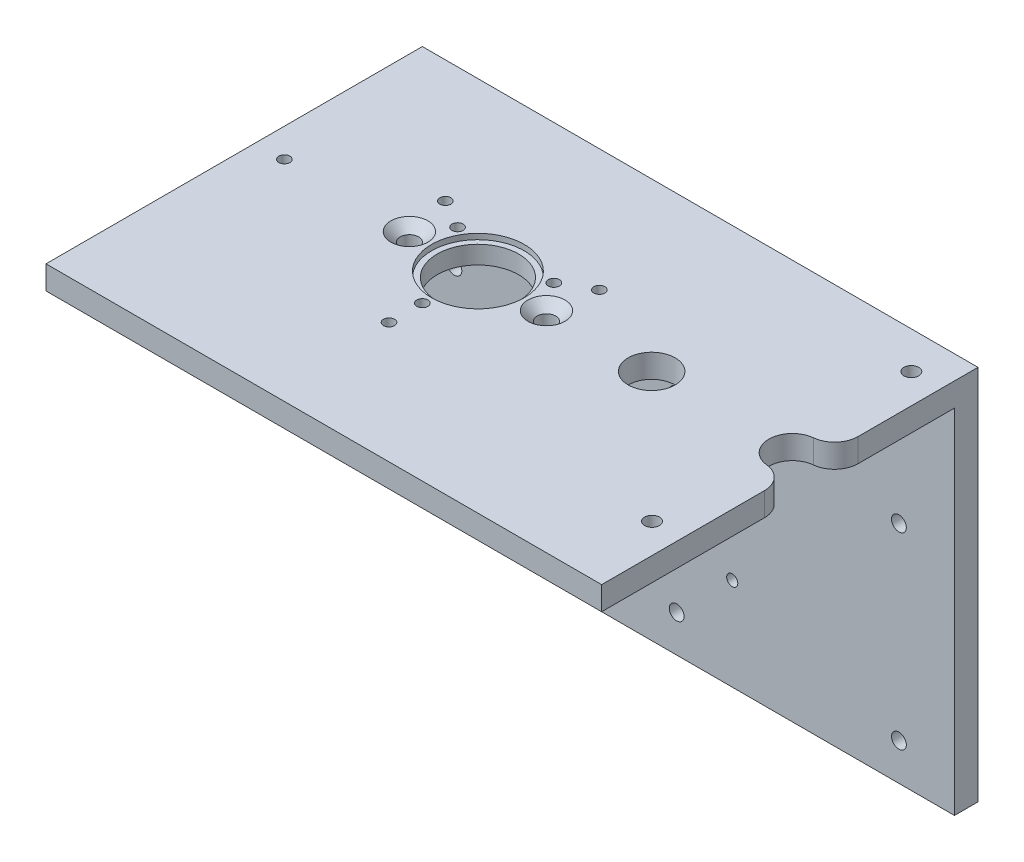
from build123d import *

# Parameters (mm, degrees)
CROQUIS1_W              = 150
CROQUIS1_H              = 101.6
SALIENTE_EXTRUIR1_DEPTH = 3.175
CROQUIS2_R              = 2
CROQUIS2_R_2            = 11
CROQUIS2_R_3            = 1.5
CROQUIS2_R_4            = 6.35
CORTAR_EXTRUIR1_DEPTH   = 91.807282197
REDONDEO1_R             = 6.35
CROQUIS3_R              = 1.5
CORTAR_EXTRUIR2_DEPTH   = 91.807282197
CORTAR_EXTRUIR3_START   = 3.175
CROQUIS4_R              = 12.5
CORTAR_EXTRUIR3_DEPTH   = 1.5
SALIENTE_EXTRUIR2_START = -6.35
CROQUIS5_W              = 150
CROQUIS5_H              = 6.35
SALIENTE_EXTRUIR2_DEPTH = 101.6
CROQUIS7_R              = 2
CORTAR_EXTRUIR5_DEPTH   = 161.109464508
CROQUIS9_R              = 2.5
CORTAR_EXTRUIR6_DEPTH   = 137.118330874
CHAFL_N1_SIZE           = 2.5
CROQUIS10_R             = 1.5
CORTAR_EXTRUIR7_DEPTH   = 157.157110389


with BuildPart() as part:
    # Croquis1 → Saliente-Extruir1 (new, symmetric)
    with BuildSketch(Plane(origin=(0, 0, 0), x_dir=(1, 0, 0), z_dir=(0, 1, 0))):
        Rectangle(CROQUIS1_W, CROQUIS1_H)
    extrude(amount=SALIENTE_EXTRUIR1_DEPTH, both=True)

    # Croquis2 → Cortar-Extruir1 (cut, through all)
    with BuildSketch(Plane(origin=(0, 3.175, 0), x_dir=(1, 0, 0), z_dir=(0, 1, 0))):
        with Locations(Location((67, 40.8, 0), (0, 0, 270))):
            Circle(CROQUIS2_R)
        with Locations(Location((67, -29.2, 0), (0, 0, 90))):
            Circle(CROQUIS2_R)
        with Locations(Location((-15, 5.8, 0), (0, 0, 270))):
            Circle(CROQUIS2_R_2)
        with Locations(Location((-67.25, 5.8, 0), (0, 0, 270))):
            Circle(CROQUIS2_R_3)
        with Locations(Location((31.9, 5.8, 0), (0, 0, 270))):
            Circle(CROQUIS2_R_4)
        with Locations((69.9, 5.8)):
            Circle(CROQUIS2_R_4)
    extrude(amount=-CORTAR_EXTRUIR1_DEPTH, mode=Mode.SUBTRACT)

    # Redondeo1
    redondeo1_edges = [part.edges().sort_by_distance(p)[0] for p in [
        (75, 0, -2.016813512),
        (75, 0, -9.583186488),
    ]]
    fillet(redondeo1_edges, radius=REDONDEO1_R)

    # Croquis3 → Cortar-Extruir2 (cut, through all)
    with BuildSketch(Plane(origin=(0, 3.175, 0), x_dir=(1, 0, 0), z_dir=(0, 1, 0))):
        with Locations(Location((-15, -9.2, 0), (0, 0, 270))):
            Circle(CROQUIS3_R)
        with Locations(Location((-15, -18.2, 0), (0, 0, 270))):
            Circle(CROQUIS3_R)
        with Locations(Location((-27.990381057, 13.3, 0), (0, 0, 270))):
            Circle(CROQUIS3_R)
        with Locations(Location((-35.784609691, 17.8, 0), (0, 0, 270))):
            Circle(CROQUIS3_R)
        with Locations(Location((-2.009618943, 13.3, 0), (0, 0, 270))):
            Circle(CROQUIS3_R)
        with Locations(Location((5.784609691, 17.8, 0), (0, 0, 270))):
            Circle(CROQUIS3_R)
    extrude(amount=-CORTAR_EXTRUIR2_DEPTH, mode=Mode.SUBTRACT)

    # Croquis4 → Cortar-Extruir3 (cut)
    with BuildSketch(Plane(origin=(0, 0, 0), x_dir=(1, 0, 0), z_dir=(0, 1, 0)).offset(CORTAR_EXTRUIR3_START)):
        with Locations(Location((-15, 5.8, 0), (0, 0, 270))):
            Circle(CROQUIS4_R)
    extrude(amount=-CORTAR_EXTRUIR3_DEPTH, mode=Mode.SUBTRACT)

    # Croquis5 → Saliente-Extruir2 (add)
    with BuildSketch(Plane.XZ.offset(3.175).offset(SALIENTE_EXTRUIR2_START)):
        with Locations((0, -47.625)):
            Rectangle(CROQUIS5_W, CROQUIS5_H)
    extrude(amount=SALIENTE_EXTRUIR2_DEPTH)

    # Croquis7 → Cortar-Extruir5 (cut, through all)
    with BuildSketch(Plane(origin=(0, 0, -50.8), x_dir=(-1, 0, 0), z_dir=(0, 0, -1))):
        with Locations((-60, -6.825)):
            Circle(CROQUIS7_R)
        with Locations((0, -6.825)):
            Circle(CROQUIS7_R)
        with Locations(Location((60, -6.825, 0), (0, 0, 180))):
            Circle(CROQUIS7_R)
        with Locations((60, -88.425)):
            Circle(CROQUIS7_R)
        with Locations(Location((0, -88.425, 0), (0, 0, 180))):
            Circle(CROQUIS7_R)
        with Locations(Location((-60, -88.425, 0), (0, 0, 180))):
            Circle(CROQUIS7_R)
        with Locations((-60, -37.625)):
            Circle(CROQUIS7_R)
        with Locations((0, -37.625)):
            Circle(CROQUIS7_R)
        with Locations(Location((60, -37.625, 0), (0, 0, 180))):
            Circle(CROQUIS7_R)
    extrude(amount=-CORTAR_EXTRUIR5_DEPTH, mode=Mode.SUBTRACT)

    # Croquis9 → Cortar-Extruir6 (cut, through all)
    with BuildSketch(Plane(origin=(0, 3.175, 0), x_dir=(1, 0, 0), z_dir=(0, 1, 0))):
        with Locations(Location((3.5, 5.8, 0), (0, 0, 270))):
            Circle(CROQUIS9_R)
        with Locations(Location((-33.5, 5.8, 0), (0, 0, 270))):
            Circle(CROQUIS9_R)
    extrude(amount=-CORTAR_EXTRUIR6_DEPTH, mode=Mode.SUBTRACT)

    # Chaflán1
    chafl_n1_edges = [part.edges().sort_by_distance(p)[0] for p in [
        (3.5, 3.175, -8.3),
        (-33.5, 3.175, -8.3),
    ]]
    chamfer(chafl_n1_edges, length=CHAFL_N1_SIZE)

    # Croquis10 → Cortar-Extruir7 (cut, through all)
    with BuildSketch(Plane.XY.offset(-44.45)):
        with Locations((15, -73.425)):
            Circle(CROQUIS10_R)
        with Locations(Location((-45, -73.425, 0), (0, 0, 180))):
            Circle(CROQUIS10_R)
    extrude(amount=-CORTAR_EXTRUIR7_DEPTH, mode=Mode.SUBTRACT)


solid = part.part
